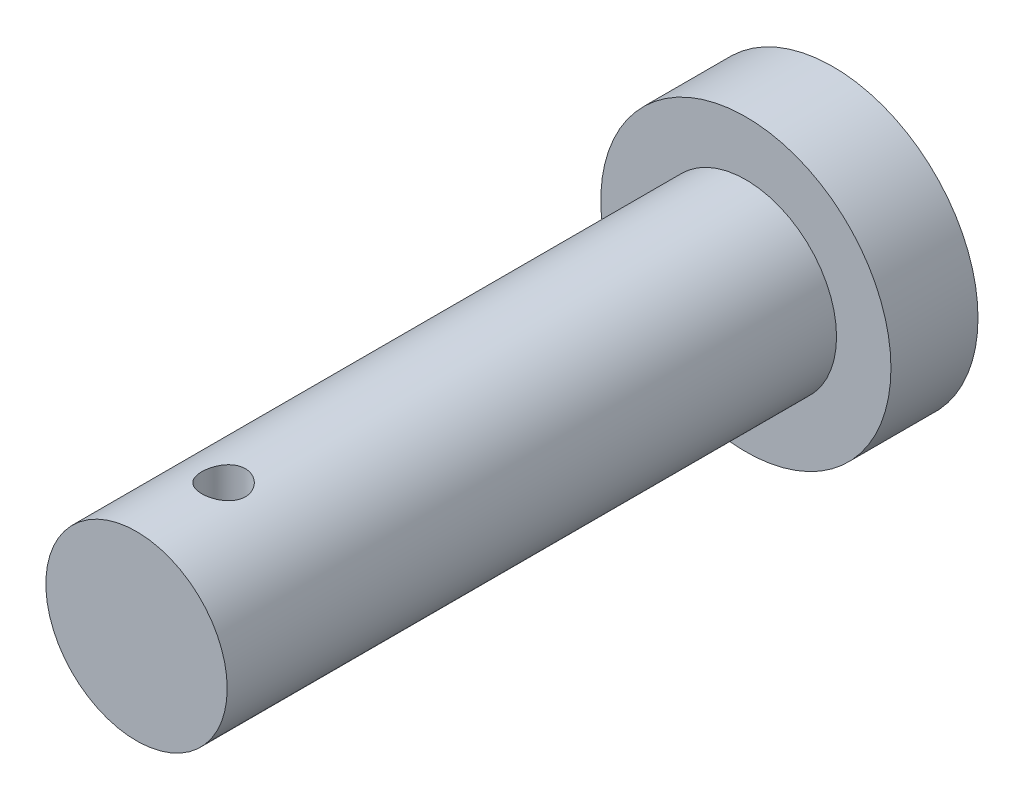
from build123d import *

# Parameters (mm, degrees)
SKETCH1_R           = 20
BOSS_EXTRUDE1_DEPTH = 12
SKETCH2_R           = 12.5
BOSS_EXTRUDE2_DEPTH = 84
SKETCH3_R           = 3
CUT_EXTRUDE1_DEPTH  = 25


with BuildPart() as part:
    # Sketch1 → Boss-Extrude1 (new body)
    with BuildSketch(Plane.XY):
        Circle(SKETCH1_R)
    extrude(amount=BOSS_EXTRUDE1_DEPTH)

    # Sketch2 → Boss-Extrude2 (add)
    with BuildSketch(Plane.XY.offset(12)):
        with Locations(Location((0, 0, 0), (0, 0, 180))):
            Circle(SKETCH2_R)
    extrude(amount=BOSS_EXTRUDE2_DEPTH)

    # Sketch3 → Cut-Extrude1 (cut, symmetric)
    with BuildSketch(Plane(origin=(0, 0, 0), x_dir=(1, 0, 0), z_dir=(0, 1, 0))):
        with Locations(Location((0, -84, 0), (0, 0, 270))):
            Circle(SKETCH3_R)
    extrude(amount=CUT_EXTRUDE1_DEPTH, both=True, mode=Mode.SUBTRACT)


solid = part.part
